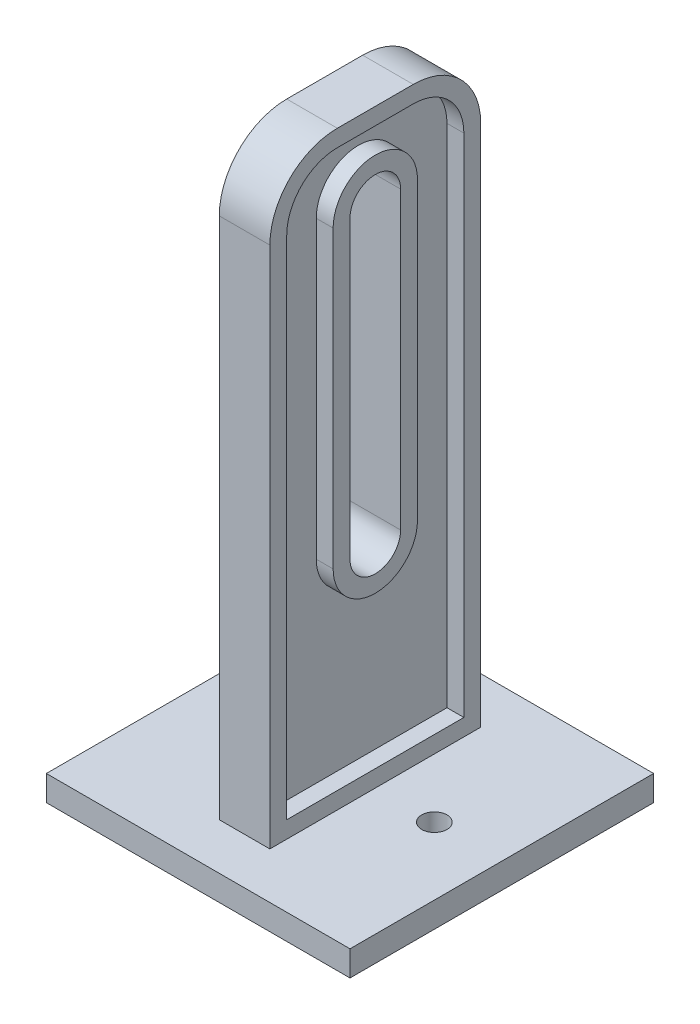
from build123d import *

# Parameters (mm, degrees)
SKETCH1_W           = 36
SKETCH1_H           = 36
BOSS_EXTRUDE1_DEPTH = 3
SKETCH2_R           = 1.5
CUT_EXTRUDE1_DEPTH  = 3
SKETCH3_W           = 6
SKETCH3_H           = 25
BOSS_EXTRUDE2_DEPTH = 70
CUT_EXTRUDE2_DEPTH  = 70
FILLET1_R           = 8
FILLET2_R           = 8
CUT_EXTRUDE3_DEPTH  = 2


with BuildPart() as part:
    # Sketch1 → Boss-Extrude1 (new body)
    with BuildSketch(Plane(origin=(0, 0, 0), x_dir=(1, 0, 0), z_dir=(0, 1, 0))):
        Rectangle(SKETCH1_W, SKETCH1_H)
    extrude(amount=BOSS_EXTRUDE1_DEPTH)

    # Sketch2 → Cut-Extrude1 (cut)
    with BuildSketch(Plane(origin=(0, 3, 0), x_dir=(1, 0, 0), z_dir=(0, 1, 0))):
        with Locations(Location((10, 0, 0), (0, 0, 270))):
            Circle(SKETCH2_R)
        with Locations(Location((-10, 0, 0), (0, 0, 270))):
            Circle(SKETCH2_R)
    extrude(amount=-CUT_EXTRUDE1_DEPTH, mode=Mode.SUBTRACT)

    # Sketch3 → Boss-Extrude2 (add)
    with BuildSketch(Plane(origin=(0, 3, 0), x_dir=(1, 0, 0), z_dir=(0, 1, 0))):
        Rectangle(SKETCH3_W, SKETCH3_H)
    extrude(amount=BOSS_EXTRUDE2_DEPTH)

    # Sketch4 → Cut-Extrude2 (cut)
    with BuildSketch(Plane(origin=(3, 0, 0), x_dir=(0, 0, -1), z_dir=(1, 0, 0))):
        with BuildLine():
            Line((-3, 28), (-3, 63))
            ThreePointArc((-3, 63), (0, 66), (3, 63))
            Line((3, 63), (3, 28))
            ThreePointArc((3, 28), (0, 25), (-3, 28))
        make_face()
    extrude(amount=-CUT_EXTRUDE2_DEPTH, mode=Mode.SUBTRACT)

    # Fillet1
    fillet1_edges = [part.edges().sort_by_distance(p)[0] for p in [
        (0, 73, -12.5),
    ]]
    fillet(fillet1_edges, radius=FILLET1_R)

    # Fillet2
    fillet2_edges = [part.edges().sort_by_distance(p)[0] for p in [
        (0, 73, 12.5),
    ]]
    fillet(fillet2_edges, radius=FILLET2_R)

    # Sketch5 → Cut-Extrude3 (cut)
    with BuildSketch(Plane(origin=(3, 0, 0), x_dir=(0, 0, -1), z_dir=(1, 0, 0))):
        with BuildLine():
            Line((4.5, 71), (-4.5, 71))
            ThreePointArc((-4.5, 71), (-8.742640687, 69.242640687), (-10.5, 65))
            Line((-10.5, 65), (-10.5, 5))
            Line((-10.5, 5), (10.5, 5))
            Line((10.5, 5), (10.5, 65))
            ThreePointArc((10.5, 65), (8.742640687, 69.242640687), (4.5, 71))
        make_face()
        with BuildLine():
            Line((5, 28), (5, 63))
            ThreePointArc((5, 63), (0, 68), (-5, 63))
            Line((-5, 63), (-5, 28))
            ThreePointArc((-5, 28), (0, 23), (5, 28))
        make_face(mode=Mode.SUBTRACT)
    extrude(amount=-CUT_EXTRUDE3_DEPTH, mode=Mode.SUBTRACT)


solid = part.part
